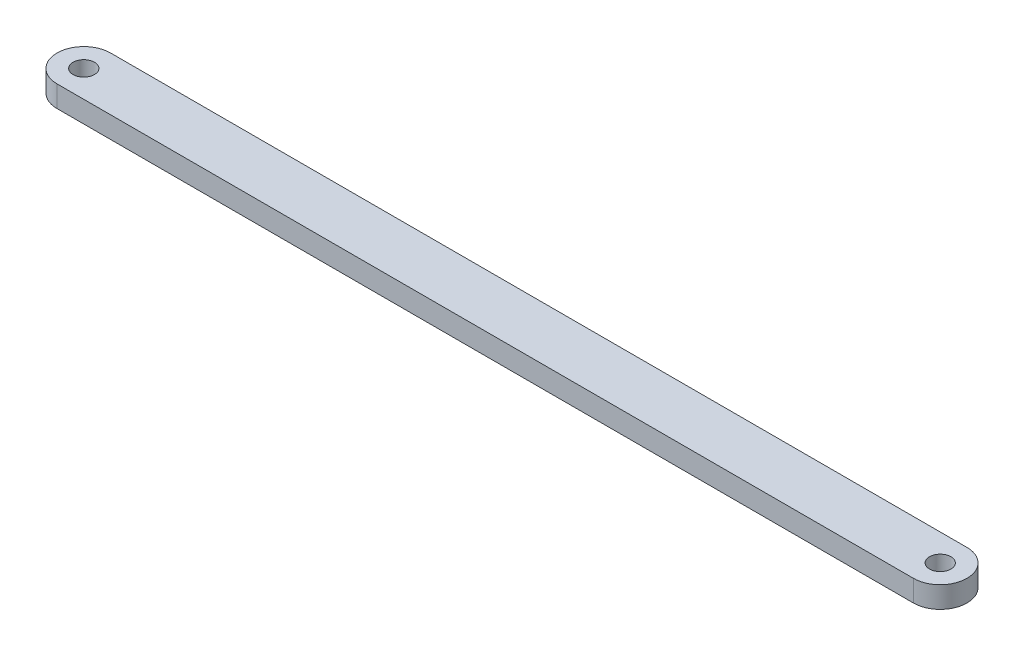
from build123d import *

# Parameters (mm, degrees)
SKETCH1_R           = 1
BOSS_EXTRUDE1_DEPTH = 2


with BuildPart() as part:
    # Sketch1 → Boss-Extrude1 (new body)
    with BuildSketch(Plane(origin=(0, 0, 0), x_dir=(1, 0, 0), z_dir=(0, 1, 0))):
        with BuildLine():
            Line((-10, 2.5), (70, 2.5))
            ThreePointArc((70, 2.5), (72.5, 0), (70, -2.5))
            Line((70, -2.5), (-10, -2.5))
            ThreePointArc((-10, -2.5), (-12.5, 0), (-10, 2.5))
        make_face()
        with Locations(Location((70, 0, 0), (0, 0, 270))):
            Circle(SKETCH1_R, mode=Mode.SUBTRACT)
        with Locations(Location((-10, 0, 0), (0, 0, 270))):
            Circle(SKETCH1_R, mode=Mode.SUBTRACT)
    extrude(amount=BOSS_EXTRUDE1_DEPTH)


solid = part.part
